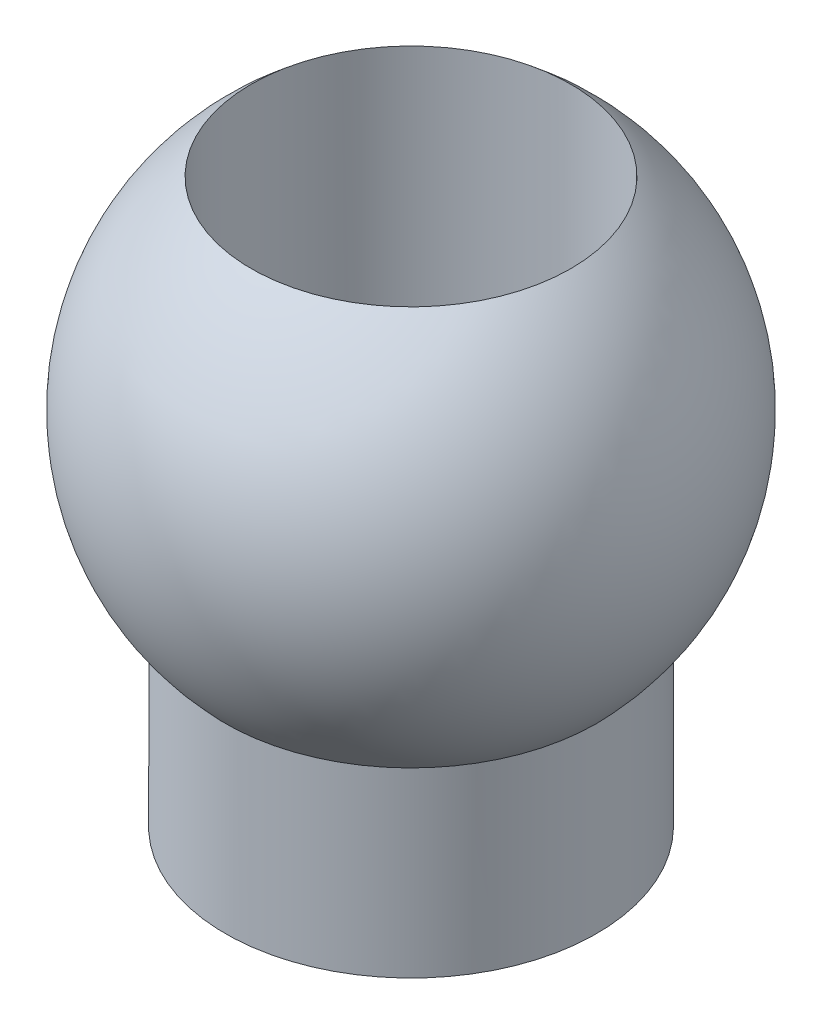
from build123d import *

# Parameters (mm, degrees)
ENL_V_MAT_EXTRU_1_DEPTH      = 7.964194139
ENL_V_MAT_EXTRU_1_DEPTH_BACK = 7.964194139
ESQUISSE2_R                  = 1.55


with BuildPart() as part:
    # Esquisse1 → Révolution1 (revolve)
    with BuildSketch(Plane.XY):
        with BuildLine():
            Line((0, 0), (0, 6))
            ThreePointArc((0, 6), (2.300797459, 4.477921803), (1.8, 1.765064843))
            Line((1.8, 1.765064843), (1.8, 0))
            Line((1.8, 0), (0, 0))
        make_face()
    revolve(axis=Axis((0, 0, 0), (0, 1, 0)))

    # Esquisse2 → Enlèv. mat.-Extru.1 (cut, two sides: drawn at the far end of the back side and taken through both)
    with BuildSketch(Plane(origin=(0, 0, 0), x_dir=(1, 0, 0), z_dir=(0, 1, 0)).offset(-ENL_V_MAT_EXTRU_1_DEPTH_BACK)):
        Circle(ESQUISSE2_R)
    extrude(amount=ENL_V_MAT_EXTRU_1_DEPTH + ENL_V_MAT_EXTRU_1_DEPTH_BACK, mode=Mode.SUBTRACT)


solid = part.part
